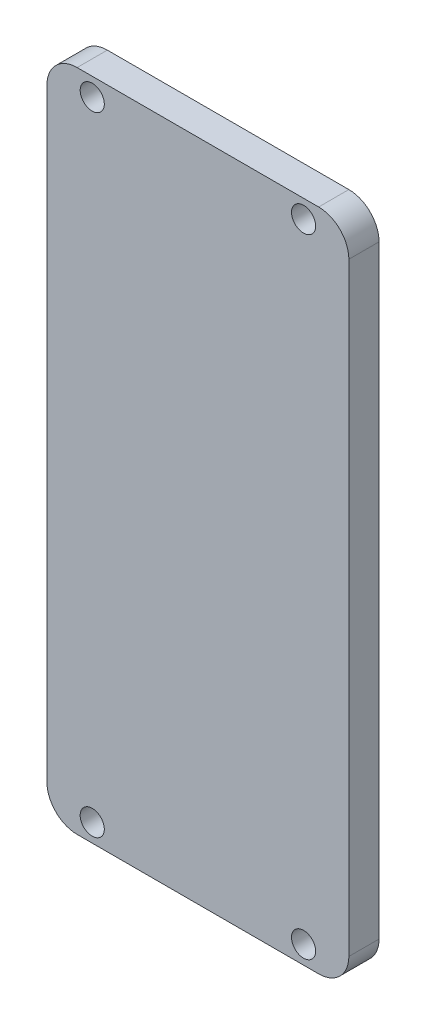
from build123d import *

# Parameters (mm, degrees)
Y_KSEKLIK_EKSTR_ZYON1_DEPTH = 5
IZIM2_R                     = 2
KES_EKSTR_ZYON1_DEPTH       = 5


with BuildPart() as part:
    # Çizim1 → Yükseklik-Ekstrüzyon1 (new body)
    with BuildSketch(Plane.XY):
        with BuildLine():
            Line((5, 0), (45, 0))
            ThreePointArc((45, 0), (48.535533906, -1.464466094), (50, -5))
            Line((50, -5), (50, -105))
            ThreePointArc((50, -105), (48.535533906, -108.535533906), (45, -110))
            Line((45, -110), (5, -110))
            ThreePointArc((5, -110), (1.464466094, -108.535533906), (0, -105))
            Line((0, -105), (0, -5))
            ThreePointArc((0, -5), (1.464466094, -1.464466094), (5, 0))
        make_face()
    extrude(amount=Y_KSEKLIK_EKSTR_ZYON1_DEPTH)

    # Çizim2 → Kes-Ekstrüzyon1 (cut)
    with BuildSketch(Plane.XY.offset(5)):
        with Locations((7.5, -107)):
            Circle(IZIM2_R)
        with Locations((42.5, -107)):
            Circle(IZIM2_R)
        with Locations((7.5, -3)):
            Circle(IZIM2_R)
        with Locations((42.5, -3)):
            Circle(IZIM2_R)
    extrude(amount=-KES_EKSTR_ZYON1_DEPTH, mode=Mode.SUBTRACT)


solid = part.part
